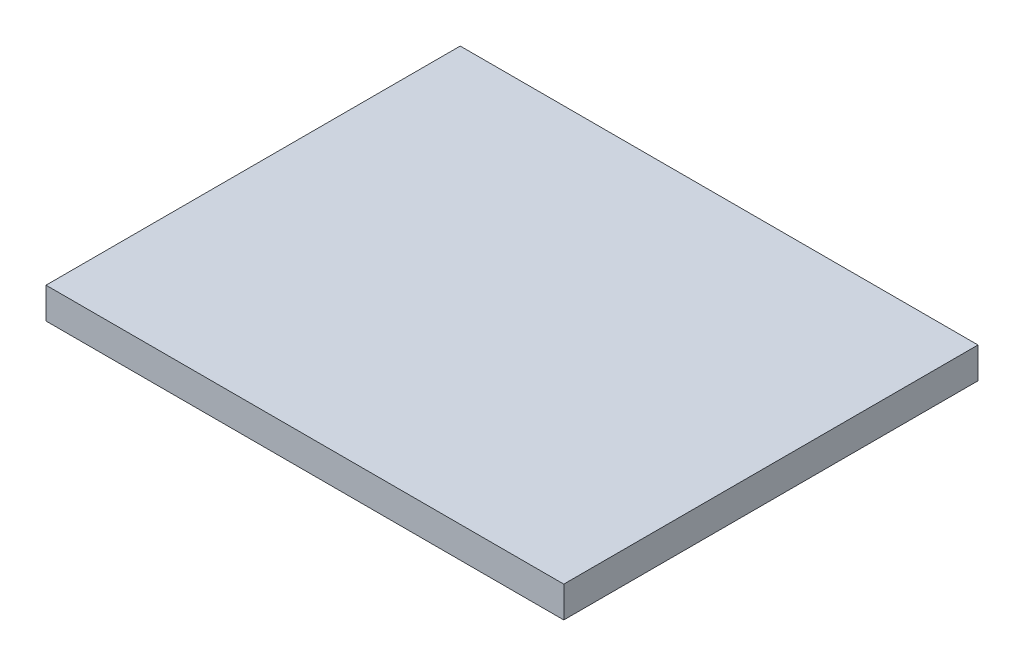
from build123d import *

# Parameters (mm, degrees)
SKETCH1_W           = 50
SKETCH1_H           = 40
BOSS_EXTRUDE1_DEPTH = 3


with BuildPart() as part:
    # Sketch1 → Boss-Extrude1 (new body)
    with BuildSketch(Plane(origin=(0, 0, 0), x_dir=(1, 0, 0), z_dir=(0, 1, 0))):
        Rectangle(SKETCH1_W, SKETCH1_H)
    extrude(amount=BOSS_EXTRUDE1_DEPTH)


solid = part.part
